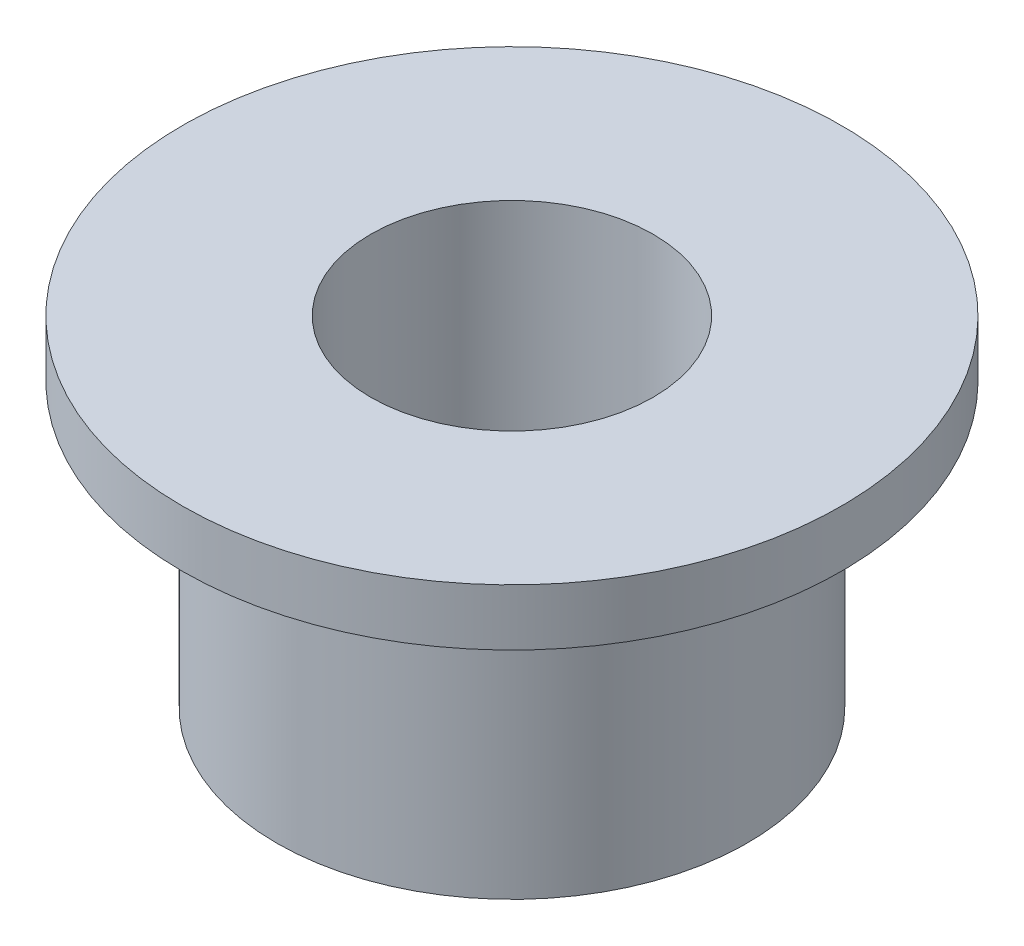
from build123d import *

# Parameters (mm, degrees)
SKETCH_2_R      = 2.5
SKETCH_2_R_2    = 1.5
EXTRUDE_1_DEPTH = 3
SKETCH_3_R      = 3.5
SKETCH_3_R_2    = 1.5
EXTRUDE_2_DEPTH = 0.6


with BuildPart() as part:
    # 草图2 → 凸台-拉伸1 (new body)
    with BuildSketch(Plane(origin=(0, 0, 0), x_dir=(1, 0, 0), z_dir=(0, 1, 0))):
        with Locations(Location((0, 0, 0), (0, 0, 270))):
            Circle(SKETCH_2_R)
        with Locations(Location((0, 0, 0), (0, 0, 270))):
            Circle(SKETCH_2_R_2, mode=Mode.SUBTRACT)
    extrude(amount=EXTRUDE_1_DEPTH)

    # 草图3 → 凸台-拉伸2 (add)
    with BuildSketch(Plane(origin=(0, 3, 0), x_dir=(1, 0, 0), z_dir=(0, 1, 0))):
        with Locations(Location((0, 0, 0), (0, 0, 270))):
            Circle(SKETCH_3_R)
        with Locations(Location((0, 0, 0), (0, 0, 270))):
            Circle(SKETCH_3_R_2, mode=Mode.SUBTRACT)
    extrude(amount=EXTRUDE_2_DEPTH)


solid = part.part
